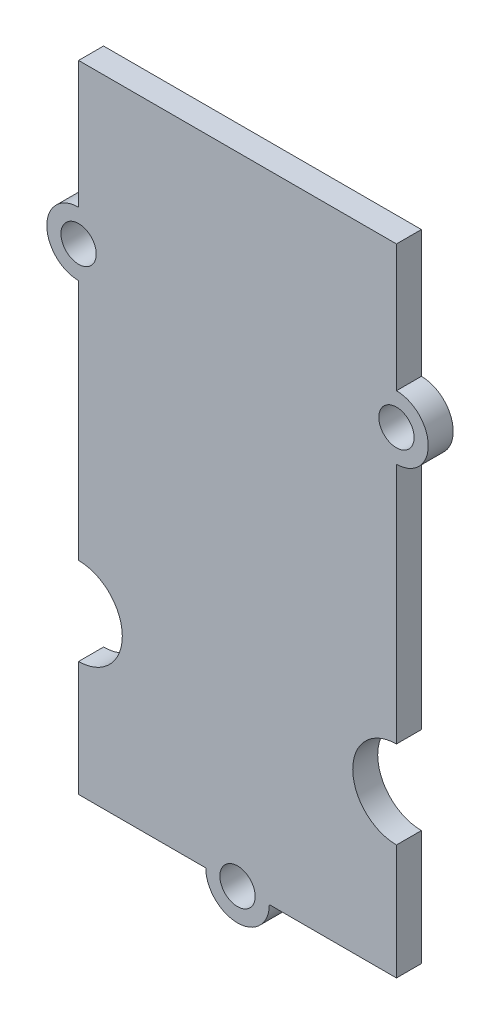
from build123d import *

# Parameters (mm, degrees)
BOSS_EXTRUDE1_DEPTH = 1.57
SKETCH2_W           = 4.040944922
SKETCH2_H           = 4.040944922
BOSS_EXTRUDE2_DEPTH = 1.57


with BuildPart() as part:
    # Sketch1 → Boss-Extrude1 (new body)
    with BuildSketch(Plane.XY):
        with BuildLine():
            Line((10, 2), (10, 40))
            Line((10, 40), (0, 40))
            Line((0, 40), (0, 32))
            ThreePointArc((0, 32), (1.414213562, 31.414213562), (2, 30))
            ThreePointArc((2, 30), (1.414213562, 28.585786438), (0, 28))
            Line((0, 28), (0, 12.75))
            ThreePointArc((0, 12.75), (1.944543648, 11.944543648), (2.75, 10))
            ThreePointArc((2.75, 10), (1.944543648, 8.055456352), (0, 7.25))
            Line((0, 7.25), (0, 0))
            Line((0, 0), (8, 0))
            ThreePointArc((8, 0), (8.585786438, 1.414213562), (10, 2))
        make_face()
        with BuildLine():
            Line((20, 40), (10, 40))
            Line((10, 40), (10, 2))
            ThreePointArc((10, 2), (11.414213562, 1.414213562), (12, 0))
            Line((12, 0), (20, 0))
            Line((20, 0), (20, 7.25))
            ThreePointArc((20, 7.25), (17.25, 10), (20, 12.75))
            Line((20, 12.75), (20, 28))
            ThreePointArc((20, 28), (18, 30), (20, 32))
            Line((20, 32), (20, 40))
        make_face()
        with BuildLine():
            ThreePointArc((2, 30), (1.414213562, 31.414213562), (0, 32))
            Line((0, 32), (0, 31.11))
            ThreePointArc((0, 31.11), (0.784888527, 30.784888527), (1.11, 30))
            ThreePointArc((1.11, 30), (0.784888527, 29.215111473), (0, 28.89))
            Line((0, 28.89), (0, 28))
            ThreePointArc((0, 28), (1.414213562, 28.585786438), (2, 30))
        make_face()
        with BuildLine():
            Line((0, 31.11), (0, 32))
            ThreePointArc((0, 32), (-2, 30), (0, 28))
            Line((0, 28), (0, 28.89))
            ThreePointArc((0, 28.89), (-1.11, 30), (0, 31.11))
        make_face()
        with BuildLine():
            ThreePointArc((22, 30), (21.414213562, 31.414213562), (20, 32))
            Line((20, 32), (20, 31.11))
            ThreePointArc((20, 31.11), (20.784888527, 30.784888527), (21.11, 30))
            ThreePointArc((21.11, 30), (20.784888527, 29.215111473), (20, 28.89))
            Line((20, 28.89), (20, 28))
            ThreePointArc((20, 28), (21.414213562, 28.585786438), (22, 30))
        make_face()
        with BuildLine():
            Line((20, 31.11), (20, 32))
            ThreePointArc((20, 32), (18, 30), (20, 28))
            Line((20, 28), (20, 28.89))
            ThreePointArc((20, 28.89), (18.89, 30), (20, 31.11))
        make_face()
        with BuildLine():
            ThreePointArc((8, 0), (10, -2), (12, 0))
            Line((12, 0), (11.11, 0))
            ThreePointArc((11.11, 0), (10, -1.11), (8.89, 0))
            Line((8.89, 0), (8, 0))
        make_face()
        with BuildLine():
            ThreePointArc((12, 0), (11.414213562, 1.414213562), (10, 2))
            Line((10, 2), (10, 1.11))
            ThreePointArc((10, 1.11), (10.784888527, 0.784888527), (11.11, 0))
            Line((11.11, 0), (12, 0))
        make_face()
        with BuildLine():
            Line((10, 1.11), (10, 2))
            ThreePointArc((10, 2), (8.585786438, 1.414213562), (8, 0))
            Line((8, 0), (8.89, 0))
            ThreePointArc((8.89, 0), (9.215111473, 0.784888527), (10, 1.11))
        make_face()
    extrude(amount=BOSS_EXTRUDE1_DEPTH)

    # Sketch2 → Boss-Extrude2 (add)
    with BuildSketch(Plane(origin=(0, 0, 0), x_dir=(-1, 0, 0), z_dir=(0, 0, -1))):
        with Locations((-10, 10)):
            Rectangle(SKETCH2_W, SKETCH2_H)
    extrude(amount=BOSS_EXTRUDE2_DEPTH)


solid = part.part
